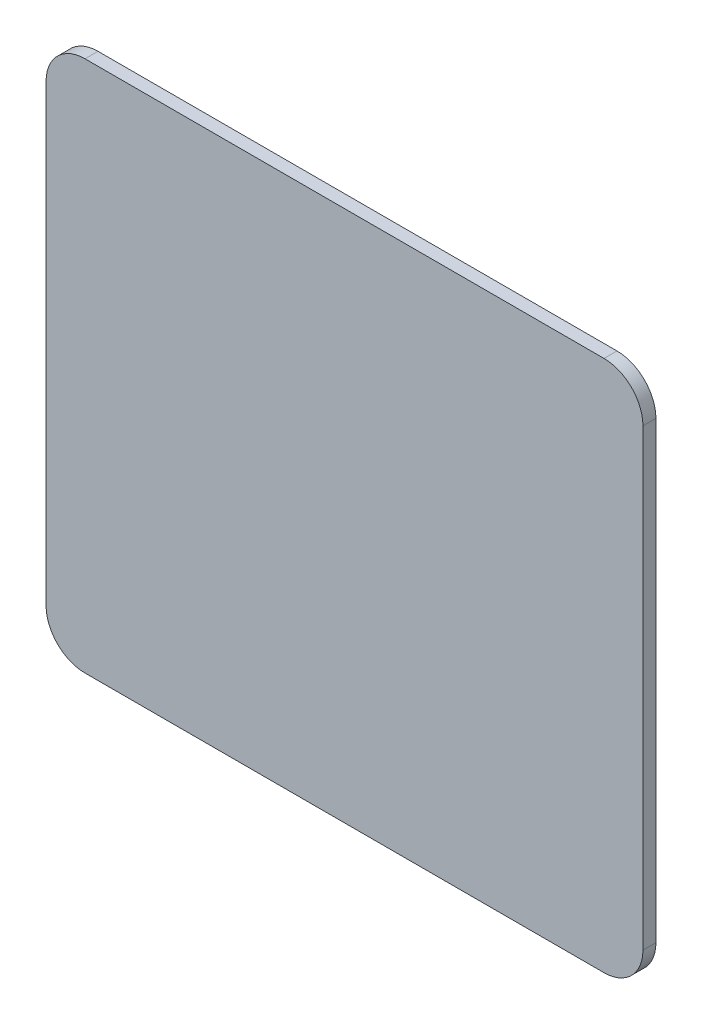
from build123d import *

# Parameters (mm, degrees)
RESSALTO_EXTRUS_O1_DEPTH = 1


with BuildPart() as part:
    # Esboço1 → Ressalto-extrusão1 (new body)
    with BuildSketch(Plane.XY):
        with BuildLine():
            Line((-22.158193819, 19.025172981), (-22.158193819, -15.974827019))
            ThreePointArc((-22.158193819, -15.974827019), (-21.279514162, -18.096147362), (-19.158193819, -18.974827019))
            Line((-19.158193819, -18.974827019), (20.841806181, -18.974827019))
            ThreePointArc((20.841806181, -18.974827019), (22.963126525, -18.096147362), (23.841806181, -15.974827019))
            Line((23.841806181, -15.974827019), (23.841806181, 19.025172981))
            ThreePointArc((23.841806181, 19.025172981), (22.963126525, 21.146493325), (20.841806181, 22.025172981))
            Line((20.841806181, 22.025172981), (-19.158193819, 22.025172981))
            ThreePointArc((-19.158193819, 22.025172981), (-21.279514162, 21.146493325), (-22.158193819, 19.025172981))
        make_face()
    extrude(amount=RESSALTO_EXTRUS_O1_DEPTH)


solid = part.part
